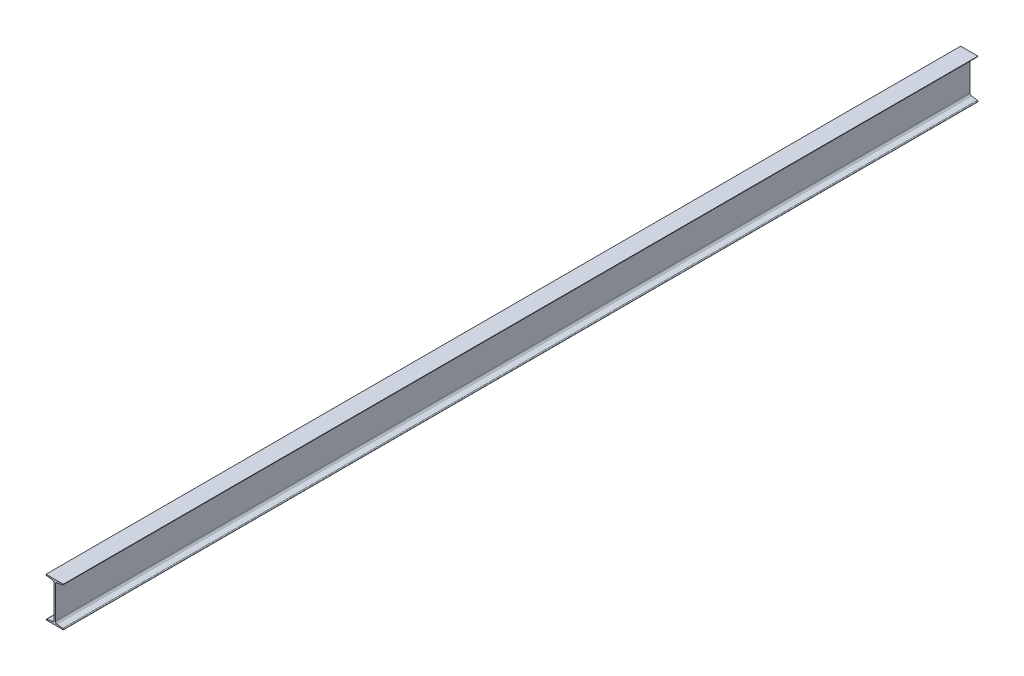
from build123d import *

# Parameters (mm, degrees)
EXTRUDE1_DEPTH = 7050


with BuildPart() as part:
    # Sketch1 → Extrude1 (new body)
    with BuildSketch(Plane.XY):
        with BuildLine():
            Line((-66.675, -152.4), (-66.675, -152.03634552))
            ThreePointArc((-66.675, -152.03634552), (-64.989504955, -147.439217289), (-60.731921268, -145.021064551))
            Line((-60.731921268, -145.021064551), (-17.728157464, -137.855561937))
            ThreePointArc((-17.728157464, -137.855561937), (-9.212990089, -133.019256462), (-5.842, -123.825))
            Line((-5.842, -123.825), (-5.842, 123.825))
            ThreePointArc((-5.842, 123.825), (-9.212990089, 133.019256462), (-17.728157464, 137.855561937))
            Line((-17.728157464, 137.855561937), (-60.731921268, 145.021064551))
            ThreePointArc((-60.731921268, 145.021064551), (-64.989504955, 147.439217289), (-66.675, 152.03634552))
            Line((-66.675, 152.03634552), (-66.675, 152.4))
            Line((-66.675, 152.4), (66.675, 152.4))
            Line((66.675, 152.4), (66.675, 152.03634552))
            ThreePointArc((66.675, 152.03634552), (64.989504955, 147.439217289), (60.731921268, 145.021064551))
            Line((60.731921268, 145.021064551), (17.728157464, 137.855561937))
            ThreePointArc((17.728157464, 137.855561937), (9.212990089, 133.019256462), (5.842, 123.825))
            Line((5.842, 123.825), (5.842, -123.825))
            ThreePointArc((5.842, -123.825), (9.212990089, -133.019256462), (17.728157464, -137.855561937))
            Line((17.728157464, -137.855561937), (60.731921268, -145.021064551))
            ThreePointArc((60.731921268, -145.021064551), (64.989504955, -147.439217289), (66.675, -152.03634552))
            Line((66.675, -152.03634552), (66.675, -152.4))
            Line((66.675, -152.4), (-66.675, -152.4))
        make_face()
    extrude(amount=EXTRUDE1_DEPTH)


solid = part.part
